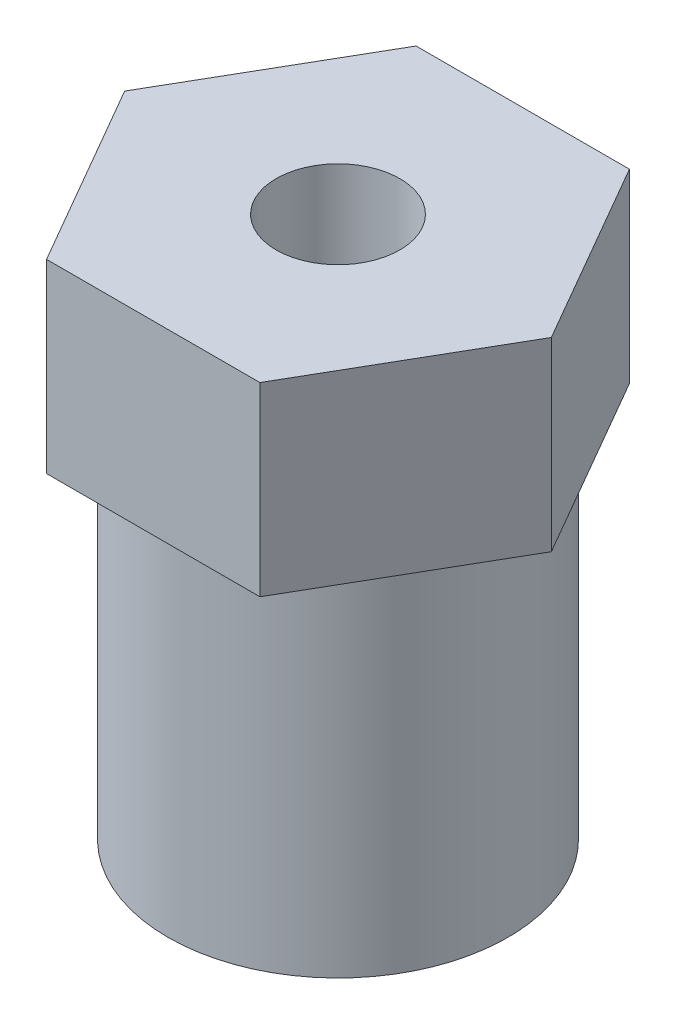
from build123d import *

# Parameters (mm, degrees)
SKETCH_1_R      = 2
EXTRUDE_1_DEPTH = 6
SKETCH_2_R      = 5.5
SKETCH_2_R_2    = 2.5
EXTRUDE_2_DEPTH = 11.5


with BuildPart() as part:
    # 草图1 → 凸台-拉伸1 (new body)
    with BuildSketch(Plane(origin=(0, 0, 0), x_dir=(1, 0, 0), z_dir=(0, 1, 0))):
        Polygon((6.899335717, 0), (3.449667858, 5.975), (-3.449667858, 5.975), (-6.899335717, 0), (-3.449667858, -5.975), (3.449667858, -5.975), align=None)
        with Locations(Location((0, 0, 0), (0, 0, 270))):
            Circle(SKETCH_1_R, mode=Mode.SUBTRACT)
    extrude(amount=EXTRUDE_1_DEPTH)

    # 草图2 → 凸台-拉伸2 (add)
    with BuildSketch(Plane.XZ):
        with Locations(Location((0, 0, 0), (0, 0, 270))):
            Circle(SKETCH_2_R)
        with Locations(Location((0, 0, 0), (0, 0, 270))):
            Circle(SKETCH_2_R_2, mode=Mode.SUBTRACT)
    extrude(amount=EXTRUDE_2_DEPTH)


solid = part.part
